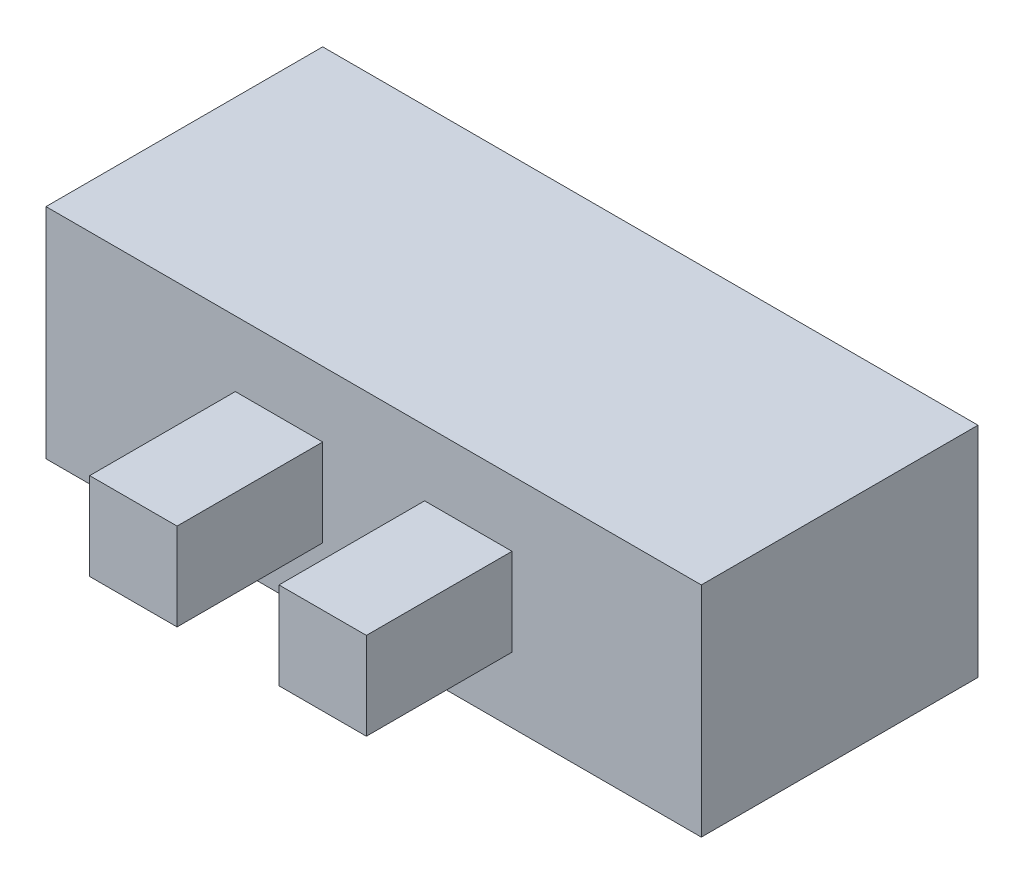
from build123d import *

# Parameters (mm, degrees)
SKETCH1_W           = 9
SKETCH1_H           = 3
BOSS_EXTRUDE1_DEPTH = 3.8
SKETCH2_W           = 1.2
SKETCH2_H           = 1.2
BOSS_EXTRUDE2_DEPTH = 2


with BuildPart() as part:
    # Sketch1 → Boss-Extrude1 (new body)
    with BuildSketch(Plane.XY):
        with Locations((4.5, -1.5)):
            Rectangle(SKETCH1_W, SKETCH1_H)
    extrude(amount=BOSS_EXTRUDE1_DEPTH)

    # Sketch2 → Boss-Extrude2 (add)
    with BuildSketch(Plane.XY.offset(3.8)):
        with Locations((5.8, -1.5)):
            Rectangle(SKETCH2_W, SKETCH2_H)
        with Locations((3.2, -1.5)):
            Rectangle(SKETCH2_W, SKETCH2_H)
    extrude(amount=BOSS_EXTRUDE2_DEPTH)


solid = part.part
